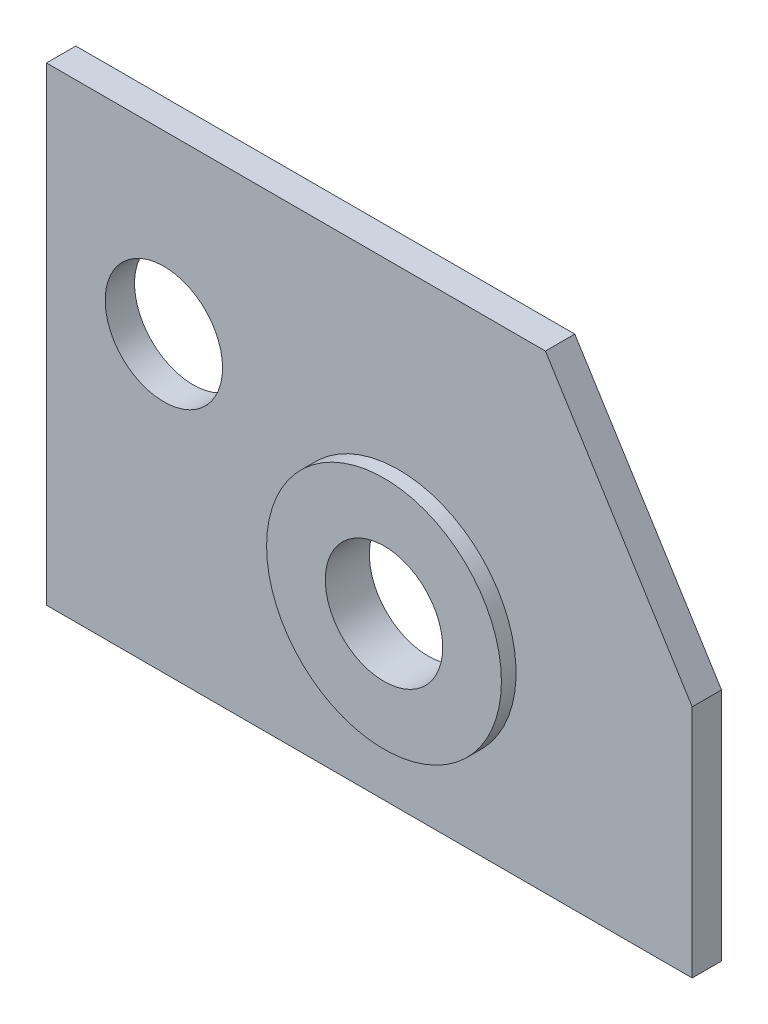
from build123d import *

# Parameters (mm, degrees)
SKETCH1_W               = 139.7
SKETCH1_H               = 101.6
BOSS_EXTRUDE1_DEPTH     = 6.35
CUT_EXTRUDE1_DEPTH      = 173.855351378
CUT_EXTRUDE1_DEPTH_BACK = 173.855351378
F_1_1_DIAMETER_HOLE1_D  = 25.4
SKETCH5_R               = 25.4
BOSS_EXTRUDE2_DEPTH     = 3.175
SKETCH6_R               = 12.7
CUT_EXTRUDE2_DEPTH      = 174.001085618


with BuildPart() as part:
    # Sketch1 → Boss-Extrude1 (new body)
    with BuildSketch(Plane.XY):
        with Locations((69.85, 50.8)):
            Rectangle(SKETCH1_W, SKETCH1_H)
    extrude(amount=BOSS_EXTRUDE1_DEPTH)

    # Sketch2 → Cut-Extrude1 (cut, two sides: drawn at the far end of the back side and taken through both)
    with BuildSketch(Plane.XY.offset(6.35).offset(-CUT_EXTRUDE1_DEPTH_BACK)):
        Polygon((-54.918344462, 362.189351139), (107.95, 101.6), (139.7, 50.8), (302.568344462, -209.789351139), (823.747046739, 115.947337785), (466.260357816, 687.926040062), align=None)
    extrude(amount=CUT_EXTRUDE1_DEPTH + CUT_EXTRUDE1_DEPTH_BACK, mode=Mode.SUBTRACT)

    # 1 (1) Diameter Hole1 (through all)
    with Locations(Plane.XY.offset(6.35)):
        with Locations((25.4, 63.5)):
            Hole(F_1_1_DIAMETER_HOLE1_D / 2)

    # Sketch5 → Boss-Extrude2 (add)
    with BuildSketch(Plane.XY.offset(6.35)):
        with Locations(Location((76.2, 38.1, 0), (0, 0, 180))):
            Circle(SKETCH5_R)
    extrude(amount=BOSS_EXTRUDE2_DEPTH)

    # Sketch6 → Cut-Extrude2 (cut, through all)
    with BuildSketch(Plane.XY.offset(9.525)):
        with Locations((76.2, 38.1)):
            Circle(SKETCH6_R)
    extrude(amount=-CUT_EXTRUDE2_DEPTH, mode=Mode.SUBTRACT)


solid = part.part
